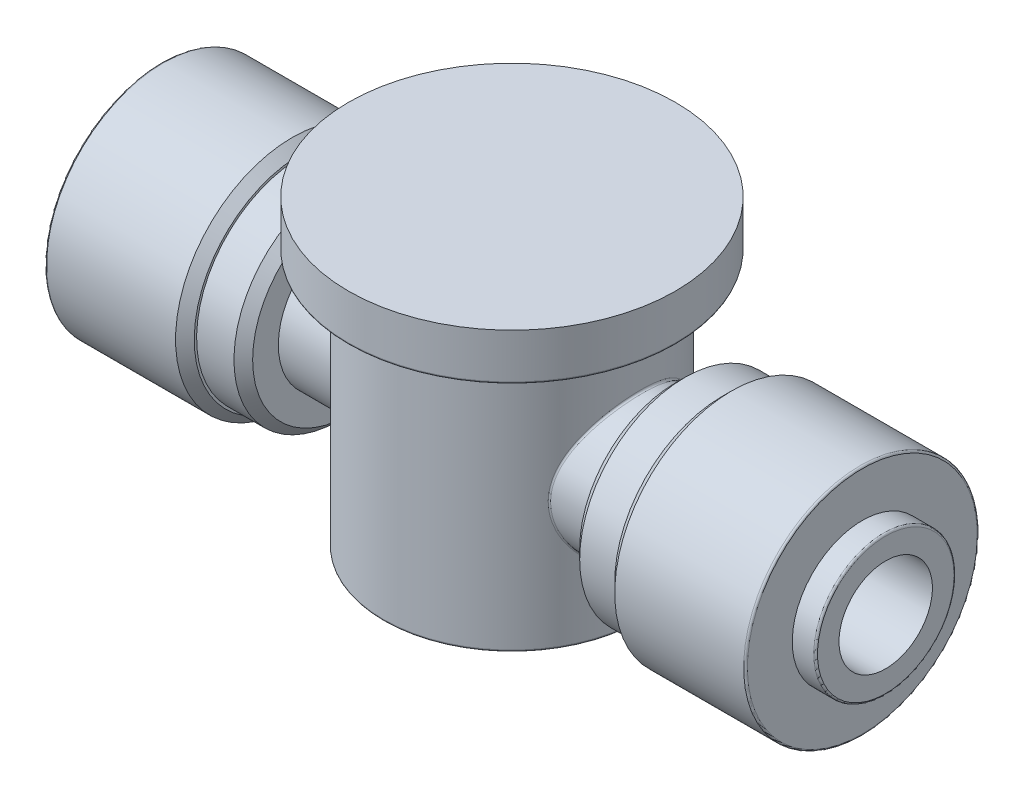
from build123d import *

# Parameters (mm, degrees)
SKETCH1_R           = 8.73125
BOSS_EXTRUDE1_DEPTH = 8.73125
SKETCH2_R           = 4.7625
BOSS_EXTRUDE2_DEPTH = 25.4
SKETCH4_R           = 11.1125
BOSS_EXTRUDE5_DEPTH = 3.175
FILLET1_R           = 0.127
CHAMFER1_SIZE       = 0.635
SKETCH5_R           = 3.175
CUT_EXTRUDE1_DEPTH  = 54.346850399


with BuildPart() as part:
    # Sketch1 → Boss-Extrude1 (new, symmetric)
    with BuildSketch(Plane(origin=(0, 0, 0), x_dir=(1, 0, 0), z_dir=(0, 1, 0))):
        with Locations(Location((0, 0, 0), (0, 0, 270))):
            Circle(SKETCH1_R)
    extrude(amount=BOSS_EXTRUDE1_DEPTH, both=True)

    # Sketch2 → Boss-Extrude2 (add, symmetric)
    with BuildSketch(Plane(origin=(0, 0, 0), x_dir=(0, 0, -1), z_dir=(1, 0, 0))):
        with Locations(Location((0, 0, 0), (0, 0, 180))):
            Circle(SKETCH2_R)
    extrude(amount=BOSS_EXTRUDE2_DEPTH, both=True)

    # Sketch3 → Revolve1 (revolve)
    with BuildSketch(Plane.XY, mode=Mode.PRIVATE) as revolve1_sk:
        Polygon((23.8125, 0), (23.8125, 7.9375), (14.2875, 7.9375), (14.2875, 7.14375), (11.1125, 7.14375), (11.1125, 0), align=None)
    revolve1 = revolve(revolve1_sk.sketch.rotate(Axis((0, 0, 0), (1, 0, 0)), 180), axis=Axis((0, 0, 0), (1, 0, 0)))

    # Mirror1: Revolve1 across plane
    add(revolve1.mirror(Plane(origin=(0, 0, 0), x_dir=(0, 0, 1), z_dir=(1, 0, 0))))

    # Sketch4 → Boss-Extrude5 (add)
    with BuildSketch(Plane(origin=(0, 8.73125, 0), x_dir=(1, 0, 0), z_dir=(0, 1, 0))):
        with Locations(Location((0, 0, 0), (0, 0, 270))):
            Circle(SKETCH4_R)
    extrude(amount=BOSS_EXTRUDE5_DEPTH)

    # Fillet1
    fillet1_edges = [part.edges().sort_by_distance(p)[0] for p in [
        (23.8125, 7.9375, 0),
        (0, -8.73125, -8.73125),
        (-23.8125, 7.9375, 0),
        (0, 8.73125, -11.1125),
        (-7.318013413, 0, -4.7625),
        (7.318013413, 0, -4.7625),
        (-25.4, 0, -4.7625),
        (25.4, 0, -4.7625),
    ]]
    fillet(fillet1_edges, radius=FILLET1_R)

    # Chamfer1
    chamfer1_edges = [part.edges().sort_by_distance(p)[0] for p in [
        (14.2875, 7.9375, 0),
        (11.1125, 7.14375, 0),
        (-14.2875, 7.9375, 0),
        (-11.1125, 7.14375, 0),
    ]]
    chamfer(chamfer1_edges, length=CHAMFER1_SIZE)

    # Sketch5 → Cut-Extrude1 (cut, through all)
    with BuildSketch(Plane.ZY.offset(25.4)):
        Circle(SKETCH5_R)
    extrude(amount=-CUT_EXTRUDE1_DEPTH, mode=Mode.SUBTRACT)


solid = part.part
